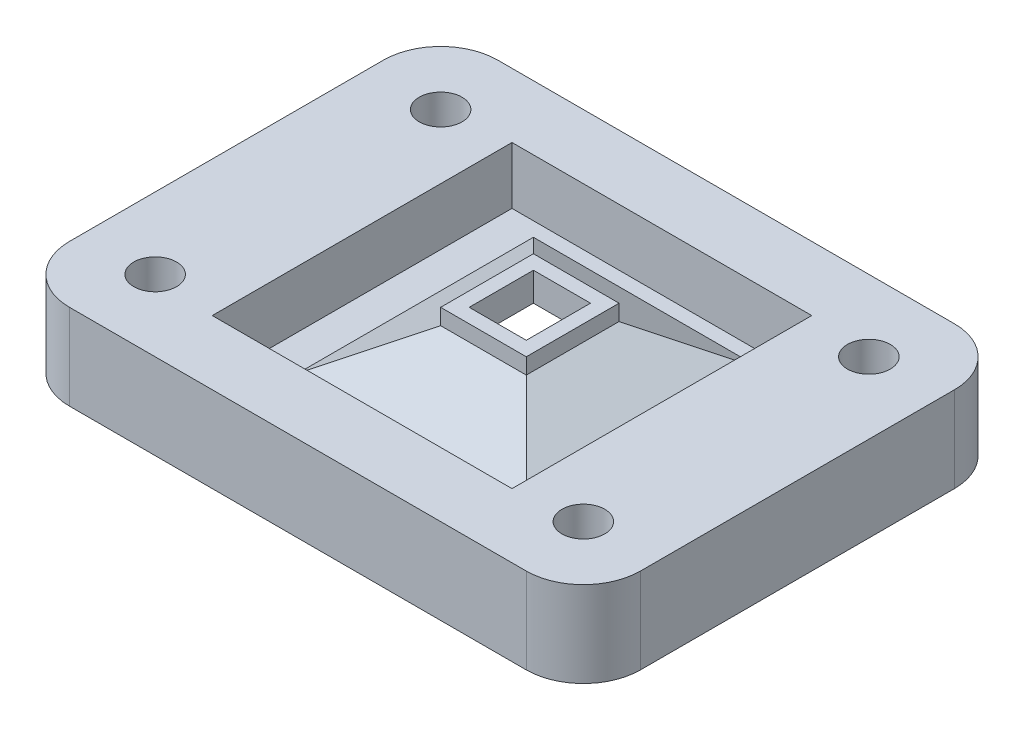
from build123d import *
from OCP.BRepFilletAPI import BRepFilletAPI_MakeChamfer

# Parameters (mm, degrees)
SKETCH1_W           = 40
SKETCH1_H           = 30
BOSS_EXTRUDE1_DEPTH = 6
SKETCH2_R           = 1.5
CUT_EXTRUDE1_DEPTH  = 6
FILLET1_R           = 4
SKETCH3_W           = 21
SKETCH3_H           = 21
CUT_EXTRUDE2_DEPTH  = 4
SKETCH6_W           = 4
SKETCH6_H           = 4.5
CUT_EXTRUDE3_DEPTH  = 2
SKETCH7_W           = 6
SKETCH7_H           = 6.5
SKETCH7_W_2         = 4
SKETCH7_H_2         = 4.5
BOSS_EXTRUDE2_DEPTH = 4
CHAMFER1_SIZE       = 4
CHAMFER1_SIZE2      = 6.92820323
CHAMFER2_SIZE       = 5
CHAMFER2_SIZE2      = 2.886751346


with BuildPart() as part:
    # Sketch1 → Boss-Extrude1 (new body)
    with BuildSketch(Plane(origin=(0, 0, 0), x_dir=(1, 0, 0), z_dir=(0, 1, 0))):
        with Locations((20, 15)):
            Rectangle(SKETCH1_W, SKETCH1_H)
    extrude(amount=BOSS_EXTRUDE1_DEPTH)

    # Sketch2 → Cut-Extrude1 (cut)
    with BuildSketch(Plane(origin=(0, 6, 0), x_dir=(1, 0, 0), z_dir=(0, 1, 0))):
        with Locations(Location((5, 5, 0), (0, 0, 270))):
            Circle(SKETCH2_R)
        with Locations(Location((5, 25, 0), (0, 0, 90))):
            Circle(SKETCH2_R)
        with Locations(Location((35, 5, 0), (0, 0, 90))):
            Circle(SKETCH2_R)
        with Locations(Location((35, 25, 0), (0, 0, 270))):
            Circle(SKETCH2_R)
    extrude(amount=-CUT_EXTRUDE1_DEPTH, mode=Mode.SUBTRACT)

    # Fillet1
    fillet1_edges = [part.edges().sort_by_distance(p)[0] for p in [
        (0, 3, -30),
        (40, 3, -30),
        (40, 3, 0),
        (0, 3, 0),
    ]]
    fillet(fillet1_edges, radius=FILLET1_R)

    # Sketch3 → Cut-Extrude2 (cut)
    with BuildSketch(Plane(origin=(0, 6, 0), x_dir=(1, 0, 0), z_dir=(0, 1, 0))):
        with Locations((20, 15)):
            Rectangle(SKETCH3_W, SKETCH3_H)
    extrude(amount=-CUT_EXTRUDE2_DEPTH, mode=Mode.SUBTRACT)

    # Sketch6 → Cut-Extrude3 (cut)
    with BuildSketch(Plane(origin=(0, 2, 0), x_dir=(1, 0, 0), z_dir=(0, 1, 0))):
        with Locations((20, 16.25)):
            Rectangle(SKETCH6_W, SKETCH6_H)
    extrude(amount=-CUT_EXTRUDE3_DEPTH, mode=Mode.SUBTRACT)

    # Sketch7 → Boss-Extrude2 (add)
    with BuildSketch(Plane(origin=(0, 2, 0), x_dir=(1, 0, 0), z_dir=(0, 1, 0))):
        with Locations((20, 16.25)):
            Rectangle(SKETCH7_W, SKETCH7_H)
        with Locations((20, 16.25)):
            Rectangle(SKETCH7_W_2, SKETCH7_H_2, mode=Mode.SUBTRACT)
    extrude(amount=BOSS_EXTRUDE2_DEPTH)

    # Chamfer1: one chamfer whose edges measure the first distance from different faces: ONE call of the kernel's chamfer builder (chamfer() names one face for all edges)
    chamfer1_edges_1 = [part.edges().sort_by_distance(p)[0] for p in [
        (20, 0, -14),
    ]]
    chamfer1_side_1 = [part.faces().sort_by_distance(p)[0] for p in [
        (20, 3, -14),
    ]]
    chamfer1_edges_2 = [part.edges().sort_by_distance(p)[0] for p in [
        (22, 0, -16.25),
    ]]
    chamfer1_side_2 = [part.faces().sort_by_distance(p)[0] for p in [
        (22, 3, -16.25),
    ]]
    chamfer1_edges_3 = [part.edges().sort_by_distance(p)[0] for p in [
        (20, 0, -18.5),
    ]]
    chamfer1_side_3 = [part.faces().sort_by_distance(p)[0] for p in [
        (20, 3, -18.5),
    ]]
    chamfer1_edges_4 = [part.edges().sort_by_distance(p)[0] for p in [
        (18, 0, -16.25),
    ]]
    chamfer1_side_4 = [part.faces().sort_by_distance(p)[0] for p in [
        (18, 3, -16.25),
    ]]
    chamfer1 = BRepFilletAPI_MakeChamfer(part.part.solid().wrapped)
    for e in chamfer1_edges_1:
        chamfer1.Add(CHAMFER1_SIZE, CHAMFER1_SIZE2, e.wrapped, chamfer1_side_1[0].wrapped)  # the first distance lies on this face
    for e in chamfer1_edges_2:
        chamfer1.Add(CHAMFER1_SIZE, CHAMFER1_SIZE2, e.wrapped, chamfer1_side_2[0].wrapped)  # the first distance lies on this face
    for e in chamfer1_edges_3:
        chamfer1.Add(CHAMFER1_SIZE, CHAMFER1_SIZE2, e.wrapped, chamfer1_side_3[0].wrapped)  # the first distance lies on this face
    for e in chamfer1_edges_4:
        chamfer1.Add(CHAMFER1_SIZE, CHAMFER1_SIZE2, e.wrapped, chamfer1_side_4[0].wrapped)  # the first distance lies on this face
    add(Compound.cast(chamfer1.Shape()), mode=Mode.REPLACE)

    # Chamfer2
    chamfer2_edges = [part.edges().sort_by_distance(p)[0] for p in [
        (17, 2, -16.25),
        (20, 2, -13),
        (23, 2, -16.25),
        (20, 2, -19.5),
    ]]
    chamfer2_side = [part.faces().sort_by_distance(p)[0] for p in [
        (20, 2, -4.796984848),
    ]]
    chamfer(chamfer2_edges, length=CHAMFER2_SIZE, length2=CHAMFER2_SIZE2, reference=chamfer2_side[0])


solid = part.part
